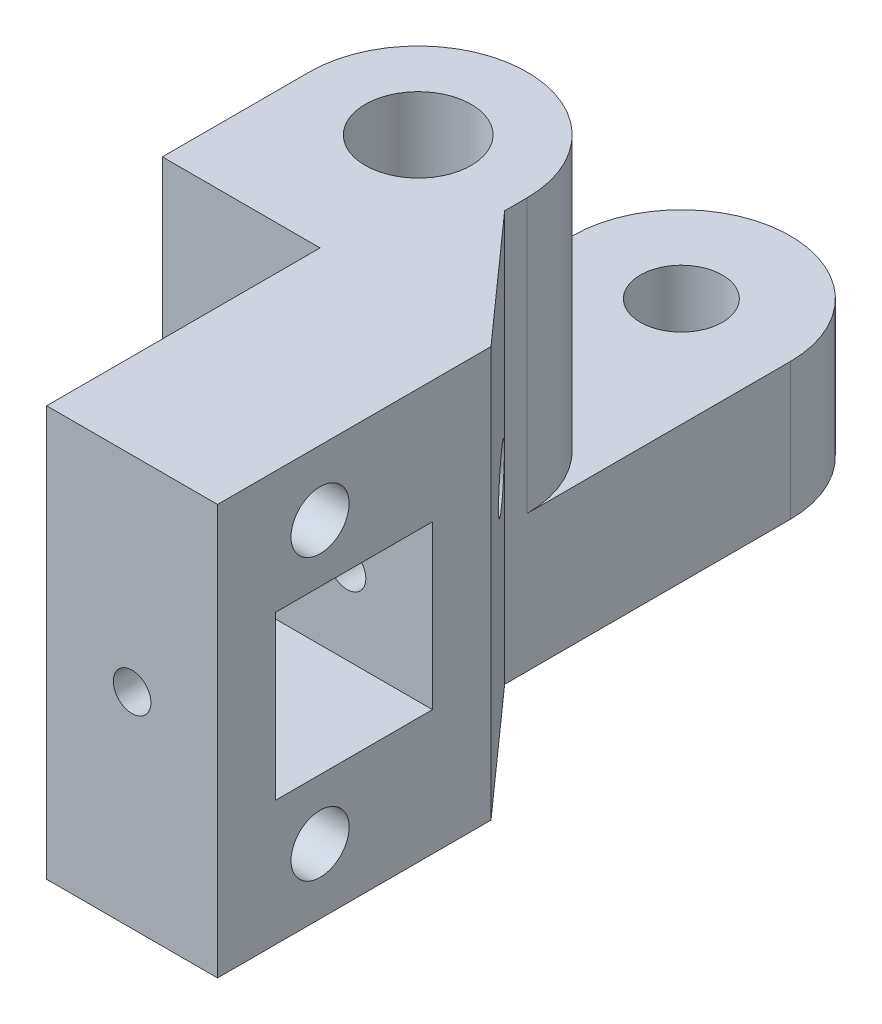
from build123d import *

# Parameters (mm, degrees)
SKETCH_1_R          = 6
SKETCH_1_R_2        = 7.75
EXTRUDE_1_DEPTH     = 60
CUT_EXTRUDE_START   = -40
SKETCH_3_R          = 15.93293451
CUT_EXTRUDE_1_DEPTH = 40
CUT_EXTRUDE_2_DEPTH = 40
SKETCH_5_R          = 4.25
CUT_EXTRUDE_3_DEPTH = 108.890486757
SKETCH_6_W          = 30
SKETCH_6_H          = 60
SKETCH_6_R          = 4.25
EXTRUDE_2_DEPTH     = 30
SKETCH_8_W          = 30
SKETCH_8_H          = 60
CUT_EXTRUDE_4_DEPTH = 30
SKETCH_10_W         = 31.86586902
SKETCH_10_H         = 40
CUT_EXTRUDE_6_DEPTH = 110
SKETCH_13_W         = 25
SKETCH_13_H         = 60
EXTRUDE_4_DEPTH     = 40
EXTRUDE_5_DEPTH     = 60
SKETCH_15_R         = 4.25
SKETCH_15_W         = 23
SKETCH_15_H         = 23.812373312
CUT_EXTRUDE_7_DEPTH = 107.065656667
SKETCH_16_R         = 2.75
CUT_EXTRUDE_8_DEPTH = 252.064107028
SKETCH_17_R         = 3.5
CUT_EXTRUDE_9_DEPTH = 60


with BuildPart() as part:
    # 草图1 → 凸台-拉伸1 (new body)
    with BuildSketch(Plane(origin=(0, 0, 0), x_dir=(1, 0, 0), z_dir=(0, 1, 0))):
        with BuildLine():
            Line((74.517406475, 16.185183146), (74.517406475, -83.814816854))
            Line((74.517406475, -83.814816854), (106.383275494, -83.814816854))
            Line((106.383275494, -83.814816854), (106.383275494, 16.185183146))
            ThreePointArc((106.383275494, 16.185183146), (90.450340985, 32.118117656), (74.517406475, 16.185183146))
        make_face()
        with Locations(Location((90.450340985, 16.185183146, 0), (0, 0, 270))):
            Circle(SKETCH_1_R, mode=Mode.SUBTRACT)
        with Locations(Location((90.450340985, -22.314816854, 0), (0, 0, 270))):
            Circle(SKETCH_1_R_2, mode=Mode.SUBTRACT)
    extrude(amount=EXTRUDE_1_DEPTH)

    # 草图3 → 切除-拉伸1 (cut)
    with BuildSketch(Plane(origin=(0, 60, 0), x_dir=(1, 0, 0), z_dir=(0, 1, 0)).offset(CUT_EXTRUDE_START)):
        with Locations((90.450340985, 16.185183146)):
            Circle(SKETCH_3_R)
    extrude(amount=CUT_EXTRUDE_1_DEPTH, mode=Mode.SUBTRACT)

    # 草图4 → 切除-拉伸2 (cut)
    with BuildSketch(Plane(origin=(0, 60, 0), x_dir=(1, 0, 0), z_dir=(0, 1, 0))):
        with BuildLine():
            Line((74.517406475, 16.185183146), (74.517406475, -22.314816854))
            ThreePointArc((74.517406475, -22.314816854), (90.450340985, -6.381882344), (106.383275494, -22.314816854))
            Line((106.383275494, -22.314816854), (106.383275494, 16.185183146))
            Line((106.383275494, 16.185183146), (74.517406475, 16.185183146))
        make_face()
    extrude(amount=-CUT_EXTRUDE_2_DEPTH, mode=Mode.SUBTRACT)

    # 草图5 → 切除-拉伸3 (cut, through all)
    with BuildSketch(Plane.ZY.offset(-74.517406475)):
        with Locations((68.814816854, 9.5)):
            Circle(SKETCH_5_R)
        with Locations((68.814816854, 50.5)):
            Circle(SKETCH_5_R)
    extrude(amount=-CUT_EXTRUDE_3_DEPTH, mode=Mode.SUBTRACT)

    # 草图6 → 凸台-拉伸2 (add)
    with BuildSketch(Plane(origin=(106.383275494, 0, 0), x_dir=(0, 0, -1), z_dir=(1, 0, 0))):
        with Locations((-68.814816854, 30)):
            Rectangle(SKETCH_6_W, SKETCH_6_H)
        with Locations(Location((-68.814816854, 50.5, 0), (0, 0, 180))):
            Circle(SKETCH_6_R, mode=Mode.SUBTRACT)
        with Locations(Location((-68.814816854, 9.5, 0), (0, 0, 180))):
            Circle(SKETCH_6_R, mode=Mode.SUBTRACT)
    extrude(amount=EXTRUDE_2_DEPTH)


with BuildPart() as body_2:
    # 镜向1: mirrored copy
    add(part.part.mirror(Plane.ZY.offset(-136.383275494)))

    # 草图8 → 切除-拉伸4 (cut)
    with BuildSketch(Plane.ZY.offset(-136.383275494)):
        with Locations((68.814816854, 30)):
            Rectangle(SKETCH_8_W, SKETCH_8_H)
    extrude(amount=-CUT_EXTRUDE_4_DEPTH, mode=Mode.SUBTRACT)

    # 草图10 → 切除-拉伸6 (cut)
    with BuildSketch(Plane(origin=(0, 60, 0), x_dir=(1, 0, 0), z_dir=(0, 1, 0))):
        with Locations((182.316210004, -63.814816854)):
            Rectangle(SKETCH_10_W, SKETCH_10_H)
    extrude(amount=-CUT_EXTRUDE_6_DEPTH, mode=Mode.SUBTRACT)

    # 草图13 → 凸台-拉伸4 (add)
    with BuildSketch(Plane.XY.offset(43.814816854)):
        with Locations((201.95918151, 30)):
            Rectangle(SKETCH_13_W, SKETCH_13_H)
    extrude(amount=EXTRUDE_4_DEPTH)

    # 草图14 → 凸台-拉伸5 (add)
    with BuildSketch(Plane(origin=(0, 60, 0), x_dir=(1, 0, 0), z_dir=(0, 1, 0))):
        Polygon((214.45918151, -43.814816854), (198.249144514, -43.814816854), (198.249144514, -25.604816854), align=None)
    extrude(amount=-EXTRUDE_5_DEPTH)

    # 草图15 → 切除-拉伸7 (cut, through all)
    with BuildSketch(Plane.ZY.offset(-189.45918151)):
        with Locations((68.814816854, 9.5)):
            Circle(SKETCH_15_R)
        with Locations((68.814816854, 50.5)):
            Circle(SKETCH_15_R)
        with Locations((63.87118854, 30.184894764)):
            Rectangle(SKETCH_15_W, SKETCH_15_H)
    extrude(amount=-CUT_EXTRUDE_7_DEPTH, mode=Mode.SUBTRACT)

    # 草图16 → 切除-拉伸8 (cut, through all)
    with BuildSketch(Plane.XY.offset(83.814816854)):
        with Locations((201.95918151, 30)):
            Circle(SKETCH_16_R)
    extrude(amount=-CUT_EXTRUDE_8_DEPTH, mode=Mode.SUBTRACT)

    # 草图17 → 切除-拉伸9 (cut)
    with BuildSketch(Plane.XY.offset(34.37118854)):
        with Locations((201.95918151, 30)):
            Circle(SKETCH_17_R)
    extrude(amount=-CUT_EXTRUDE_9_DEPTH, mode=Mode.SUBTRACT)


solid = body_2.part
